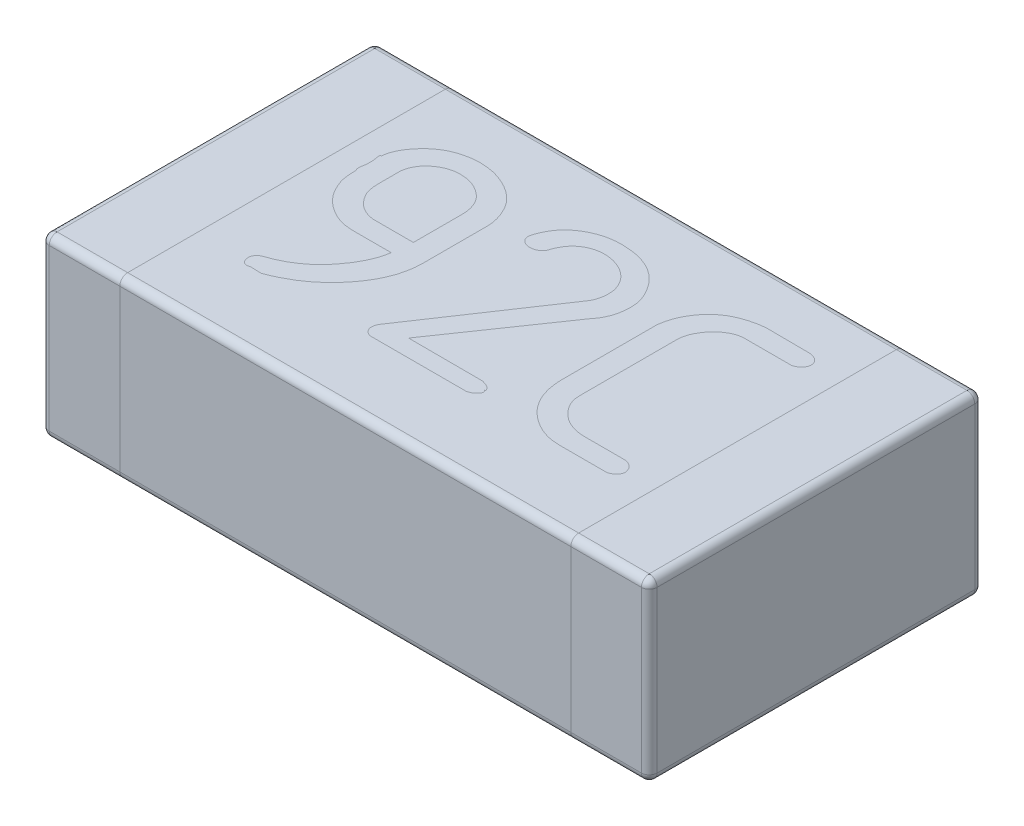
from build123d import *

# Parameters (mm, degrees)
BOSS_EXTRUDE1_DEPTH = 0.225
FILLET2_R           = 0.02


with BuildPart() as part:
    # Sketch1 → Boss-Extrude1 (new, symmetric)
    with BuildSketch(Plane(origin=(0, 0, 0), x_dir=(1, 0, 0), z_dir=(0, 1, 0))):
        with BuildLine():
            Line((-0.755, -0.425), (0.755, -0.425))
            ThreePointArc((0.755, -0.425), (0.769142136, -0.419142136), (0.775, -0.405))
            Line((0.775, -0.405), (0.775, 0.405))
            ThreePointArc((0.775, 0.405), (0.769142136, 0.419142136), (0.755, 0.425))
            Line((0.755, 0.425), (-0.755, 0.425))
            ThreePointArc((-0.755, 0.425), (-0.769142136, 0.419142136), (-0.775, 0.405))
            Line((-0.775, 0.405), (-0.775, -0.405))
            ThreePointArc((-0.775, -0.405), (-0.769142136, -0.419142136), (-0.755, -0.425))
        make_face()
    extrude(amount=BOSS_EXTRUDE1_DEPTH, both=True)

    # Fillet2
    fillet2_edges = [part.edges().sort_by_distance(p)[0] for p in [
        (0.769142136, 0.225, 0.419142136),
        (0, -0.225, 0.425),
        (-0.769142136, -0.225, 0.419142136),
        (0, -0.225, 0.425),
        (0, -0.225, 0.425),
        (0, -0.225, -0.425),
        (0, -0.225, -0.425),
        (0.775, 0.225, 0),
        (0.769142136, 0.225, -0.419142136),
        (0, 0.225, -0.425),
        (-0.769142136, 0.225, -0.419142136),
        (-0.775, 0.225, 0),
        (-0.769142136, 0.225, 0.419142136),
        (0, 0.225, 0.425),
        (-0.775, -0.225, 0),
        (-0.769142136, -0.225, -0.419142136),
        (0, -0.225, -0.425),
        (0, 0.225, 0.425),
        (0, 0.225, -0.425),
        (0.769142136, -0.225, -0.419142136),
        (0.775, -0.225, 0),
        (0, 0.225, -0.425),
        (0, 0.225, 0.425),
        (0.769142136, -0.225, 0.419142136),
    ]]
    fillet(fillet2_edges, radius=FILLET2_R)


solid = part.part
